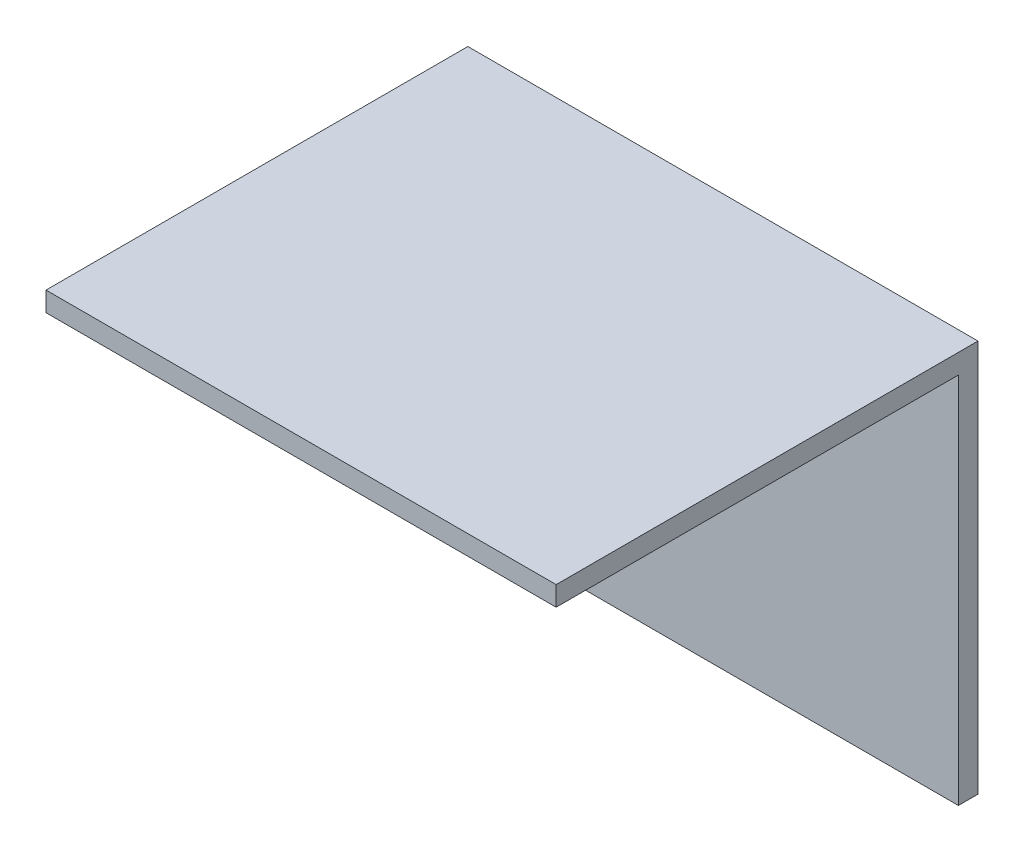
from build123d import *

# Parameters (mm, degrees)
ESQUISSE1_W             = 52
ESQUISSE1_H             = 40
BOSS_EXTRU_1_DEPTH      = 43
ESQUISSE2_W             = 48.222048012
ESQUISSE2_H             = 36
ENL_V_MAT_EXTRU_1_DEPTH = 50
ESQUISSE3_W             = 72.686110251
ESQUISSE3_H             = 50.534375484
ENL_V_MAT_EXTRU_2_DEPTH = 38


with BuildPart() as part:
    # Esquisse1 → Boss.-Extru.1 (new body)
    with BuildSketch(Plane.XY):
        Rectangle(ESQUISSE1_W, ESQUISSE1_H)
    extrude(amount=BOSS_EXTRU_1_DEPTH)

    # Esquisse2 → Enlèv. mat.-Extru.1 (cut)
    with BuildSketch(Plane.ZY.offset(26)):
        with Locations((26.111024006, 0)):
            Rectangle(ESQUISSE2_W, ESQUISSE2_H)
    extrude(amount=-ENL_V_MAT_EXTRU_1_DEPTH, mode=Mode.SUBTRACT)

    # Esquisse3 → Enlèv. mat.-Extru.2 (cut)
    with BuildSketch(Plane.XZ.offset(20)):
        with Locations((1.657877156, 27.267187742)):
            Rectangle(ESQUISSE3_W, ESQUISSE3_H)
    extrude(amount=-ENL_V_MAT_EXTRU_2_DEPTH, mode=Mode.SUBTRACT)


solid = part.part
